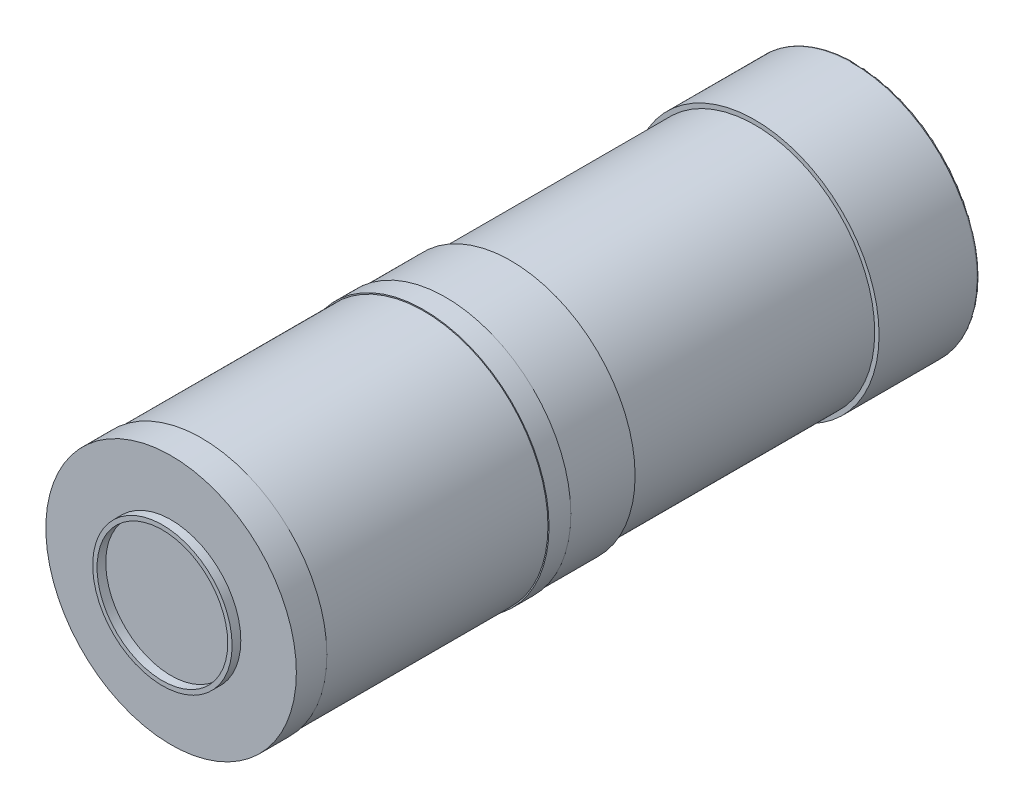
from build123d import *

# Parameters (mm, degrees)
ESQUISSE1_R        = 28.5
BOSS_EXTRU_1_DEPTH = 23
ESQUISSE3_R        = 27.5
BOSS_EXTRU_2_DEPTH = 56
ESQUISSE4_R        = 28.5
BOSS_EXTRU_3_DEPTH = 15
ESQUISSE5_R        = 28.75
BOSS_EXTRU_4_DEPTH = 5
ESQUISSE6_R        = 28.5
BOSS_EXTRU_5_DEPTH = 51
ESQUISSE7_R        = 28.75
BOSS_EXTRU_6_DEPTH = 7
CONG_1_R           = 0.5
ESQUISSE8_R        = 16
ESQUISSE8_R_2      = 15
BOSS_EXTRU_7_DEPTH = 2


with BuildPart() as part:
    # Esquisse1 → Boss.-Extru.1 (new body)
    with BuildSketch(Plane.XY):
        Circle(ESQUISSE1_R)
    extrude(amount=BOSS_EXTRU_1_DEPTH)

    # Esquisse3 → Boss.-Extru.2 (add)
    with BuildSketch(Plane.XY.offset(23)):
        Circle(ESQUISSE3_R)
    extrude(amount=BOSS_EXTRU_2_DEPTH)

    # Esquisse4 → Boss.-Extru.3 (add)
    with BuildSketch(Plane.XY.offset(79)):
        Circle(ESQUISSE4_R)
    extrude(amount=BOSS_EXTRU_3_DEPTH)

    # Esquisse5 → Boss.-Extru.4 (add)
    with BuildSketch(Plane.XY.offset(94)):
        Circle(ESQUISSE5_R)
    extrude(amount=BOSS_EXTRU_4_DEPTH)

    # Esquisse6 → Boss.-Extru.5 (add)
    with BuildSketch(Plane.XY.offset(99)):
        Circle(ESQUISSE6_R)
    extrude(amount=BOSS_EXTRU_5_DEPTH)

    # Esquisse7 → Boss.-Extru.6 (add)
    with BuildSketch(Plane.XY.offset(150)):
        Circle(ESQUISSE7_R)
    extrude(amount=BOSS_EXTRU_6_DEPTH)

    # Congé1
    cong_1_edges = [part.edges().sort_by_distance(p)[0] for p in [
        (-28.5, 0, 0),
    ]]
    fillet(cong_1_edges, radius=CONG_1_R)

    # Esquisse8 → Boss.-Extru.7 (add)
    with BuildSketch(Plane.XY.offset(157)):
        Circle(ESQUISSE8_R)
        Circle(ESQUISSE8_R_2, mode=Mode.SUBTRACT)
    extrude(amount=BOSS_EXTRU_7_DEPTH)


solid = part.part
